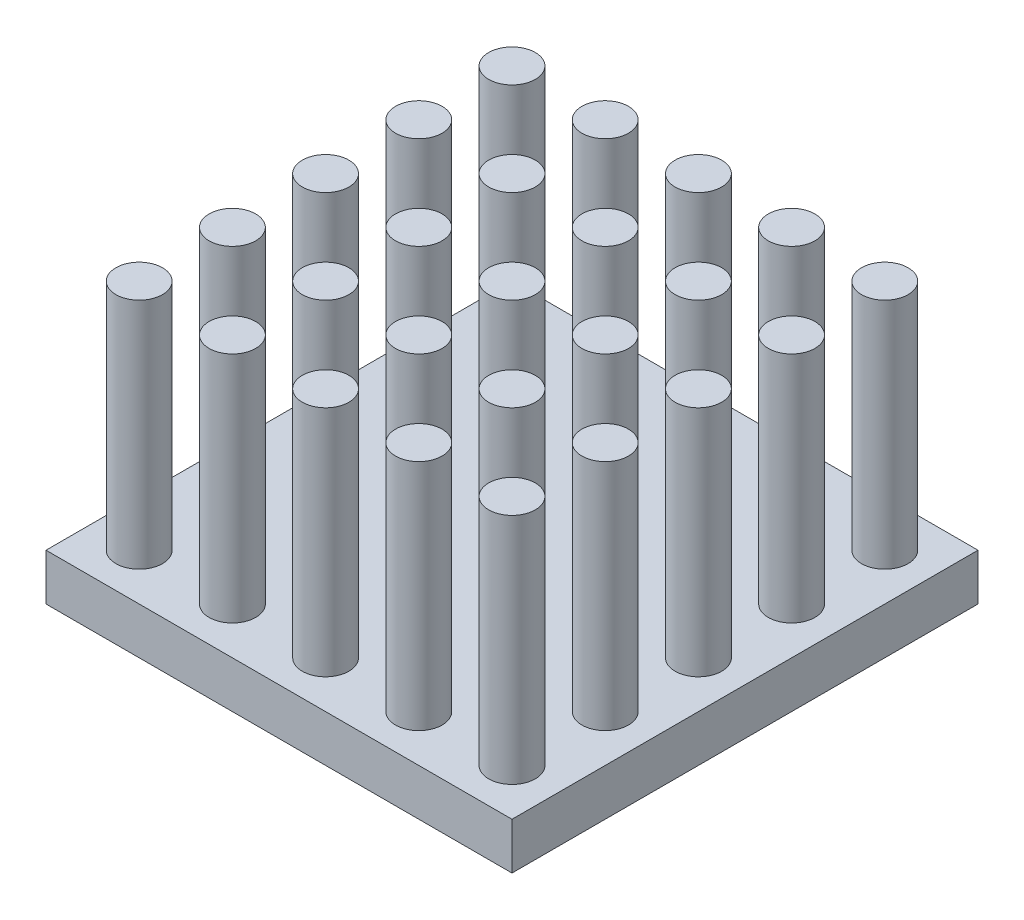
from build123d import *

# Parameters (mm, degrees)
SKETCH_1_W                        = 10
SKETCH_1_H                        = 10
EXTRUDE_1_DEPTH                   = 1
SKETCH_2_R                        = 0.5
EXTRUDE_2_DEPTH                   = 5
PATTERN_LINEAR_1_COUNT            = 5
PATTERN_LINEAR_1_PITCH            = 2
PATTERN_LINEAR_2_COUNT            = 5
PATTERN_LINEAR_2_PITCH            = 2
PATTERN_LINEAR_2_COPY_1_SKETCH_R  = 0.5
PATTERN_LINEAR_2_COPY_1_DEPTH     = 5
PATTERN_LINEAR_2_COPY_2_SKETCH_R  = 0.5
PATTERN_LINEAR_2_COPY_2_DEPTH     = 5
PATTERN_LINEAR_2_COPY_3_SKETCH_R  = 0.5
PATTERN_LINEAR_2_COPY_3_DEPTH     = 5
PATTERN_LINEAR_2_COPY_4_SKETCH_R  = 0.5
PATTERN_LINEAR_2_COPY_4_DEPTH     = 5
PATTERN_LINEAR_2_COPY_5_SKETCH_R  = 0.5
PATTERN_LINEAR_2_COPY_5_DEPTH     = 5
PATTERN_LINEAR_2_COPY_6_SKETCH_R  = 0.5
PATTERN_LINEAR_2_COPY_6_DEPTH     = 5
PATTERN_LINEAR_2_COPY_7_SKETCH_R  = 0.5
PATTERN_LINEAR_2_COPY_7_DEPTH     = 5
PATTERN_LINEAR_2_COPY_8_SKETCH_R  = 0.5
PATTERN_LINEAR_2_COPY_8_DEPTH     = 5
PATTERN_LINEAR_2_COPY_9_SKETCH_R  = 0.5
PATTERN_LINEAR_2_COPY_9_DEPTH     = 5
PATTERN_LINEAR_2_COPY_10_SKETCH_R = 0.5
PATTERN_LINEAR_2_COPY_10_DEPTH    = 5
PATTERN_LINEAR_2_COPY_11_SKETCH_R = 0.5
PATTERN_LINEAR_2_COPY_11_DEPTH    = 5
PATTERN_LINEAR_2_COPY_12_SKETCH_R = 0.5
PATTERN_LINEAR_2_COPY_12_DEPTH    = 5
PATTERN_LINEAR_2_COPY_13_SKETCH_R = 0.5
PATTERN_LINEAR_2_COPY_13_DEPTH    = 5
PATTERN_LINEAR_2_COPY_14_SKETCH_R = 0.5
PATTERN_LINEAR_2_COPY_14_DEPTH    = 5
PATTERN_LINEAR_2_COPY_15_SKETCH_R = 0.5
PATTERN_LINEAR_2_COPY_15_DEPTH    = 5
PATTERN_LINEAR_2_COPY_16_SKETCH_R = 0.5
PATTERN_LINEAR_2_COPY_16_DEPTH    = 5


with BuildPart() as part:
    # 草圖1 → 填料-伸長1 (new body)
    with BuildSketch(Plane(origin=(0, 0, 0), x_dir=(1, 0, 0), z_dir=(0, 1, 0))):
        Rectangle(SKETCH_1_W, SKETCH_1_H)
    extrude(amount=EXTRUDE_1_DEPTH)

    # 草圖2 → 填料-伸長2 (add)
    with BuildSketch(Plane(origin=(0, 1, 0), x_dir=(1, 0, 0), z_dir=(0, 1, 0))):
        with Locations(Location((-4, 4, 0), (0, 0, 90))):
            Circle(SKETCH_2_R)
    extrude_2 = extrude(amount=EXTRUDE_2_DEPTH)

    # 直線複製排列1: 填料-伸長2 ×5
    with Locations(*[(i * PATTERN_LINEAR_1_PITCH, 0, 0) for i in range(1, PATTERN_LINEAR_1_COUNT)]):
        add(extrude_2)

    # 直線複製排列2: 填料-伸長2 ×5
    with Locations(*[(0, 0, i * PATTERN_LINEAR_2_PITCH) for i in range(1, PATTERN_LINEAR_2_COUNT)]):
        add(extrude_2)

    # 直線複製排列2 copy 1 sketch → 直線複製排列2 copy 1 (add)
    with BuildSketch(Plane(origin=(2, 1, 2), x_dir=(1, 0, 0), z_dir=(0, 1, 0))):
        with Locations(Location((-4, 4, 0), (0, 0, 90))):
            Circle(PATTERN_LINEAR_2_COPY_1_SKETCH_R)
    extrude(amount=PATTERN_LINEAR_2_COPY_1_DEPTH)

    # 直線複製排列2 copy 2 sketch → 直線複製排列2 copy 2 (add)
    with BuildSketch(Plane(origin=(2, 1, 4), x_dir=(1, 0, 0), z_dir=(0, 1, 0))):
        with Locations(Location((-4, 4, 0), (0, 0, 90))):
            Circle(PATTERN_LINEAR_2_COPY_2_SKETCH_R)
    extrude(amount=PATTERN_LINEAR_2_COPY_2_DEPTH)

    # 直線複製排列2 copy 3 sketch → 直線複製排列2 copy 3 (add)
    with BuildSketch(Plane(origin=(2, 1, 6), x_dir=(1, 0, 0), z_dir=(0, 1, 0))):
        with Locations(Location((-4, 4, 0), (0, 0, 90))):
            Circle(PATTERN_LINEAR_2_COPY_3_SKETCH_R)
    extrude(amount=PATTERN_LINEAR_2_COPY_3_DEPTH)

    # 直線複製排列2 copy 4 sketch → 直線複製排列2 copy 4 (add)
    with BuildSketch(Plane(origin=(2, 1, 8), x_dir=(1, 0, 0), z_dir=(0, 1, 0))):
        with Locations(Location((-4, 4, 0), (0, 0, 90))):
            Circle(PATTERN_LINEAR_2_COPY_4_SKETCH_R)
    extrude(amount=PATTERN_LINEAR_2_COPY_4_DEPTH)

    # 直線複製排列2 copy 5 sketch → 直線複製排列2 copy 5 (add)
    with BuildSketch(Plane(origin=(4, 1, 2), x_dir=(1, 0, 0), z_dir=(0, 1, 0))):
        with Locations(Location((-4, 4, 0), (0, 0, 90))):
            Circle(PATTERN_LINEAR_2_COPY_5_SKETCH_R)
    extrude(amount=PATTERN_LINEAR_2_COPY_5_DEPTH)

    # 直線複製排列2 copy 6 sketch → 直線複製排列2 copy 6 (add)
    with BuildSketch(Plane(origin=(4, 1, 4), x_dir=(1, 0, 0), z_dir=(0, 1, 0))):
        with Locations(Location((-4, 4, 0), (0, 0, 90))):
            Circle(PATTERN_LINEAR_2_COPY_6_SKETCH_R)
    extrude(amount=PATTERN_LINEAR_2_COPY_6_DEPTH)

    # 直線複製排列2 copy 7 sketch → 直線複製排列2 copy 7 (add)
    with BuildSketch(Plane(origin=(4, 1, 6), x_dir=(1, 0, 0), z_dir=(0, 1, 0))):
        with Locations(Location((-4, 4, 0), (0, 0, 90))):
            Circle(PATTERN_LINEAR_2_COPY_7_SKETCH_R)
    extrude(amount=PATTERN_LINEAR_2_COPY_7_DEPTH)

    # 直線複製排列2 copy 8 sketch → 直線複製排列2 copy 8 (add)
    with BuildSketch(Plane(origin=(4, 1, 8), x_dir=(1, 0, 0), z_dir=(0, 1, 0))):
        with Locations(Location((-4, 4, 0), (0, 0, 90))):
            Circle(PATTERN_LINEAR_2_COPY_8_SKETCH_R)
    extrude(amount=PATTERN_LINEAR_2_COPY_8_DEPTH)

    # 直線複製排列2 copy 9 sketch → 直線複製排列2 copy 9 (add)
    with BuildSketch(Plane(origin=(6, 1, 2), x_dir=(1, 0, 0), z_dir=(0, 1, 0))):
        with Locations(Location((-4, 4, 0), (0, 0, 90))):
            Circle(PATTERN_LINEAR_2_COPY_9_SKETCH_R)
    extrude(amount=PATTERN_LINEAR_2_COPY_9_DEPTH)

    # 直線複製排列2 copy 10 sketch → 直線複製排列2 copy 10 (add)
    with BuildSketch(Plane(origin=(6, 1, 4), x_dir=(1, 0, 0), z_dir=(0, 1, 0))):
        with Locations(Location((-4, 4, 0), (0, 0, 90))):
            Circle(PATTERN_LINEAR_2_COPY_10_SKETCH_R)
    extrude(amount=PATTERN_LINEAR_2_COPY_10_DEPTH)

    # 直線複製排列2 copy 11 sketch → 直線複製排列2 copy 11 (add)
    with BuildSketch(Plane(origin=(6, 1, 6), x_dir=(1, 0, 0), z_dir=(0, 1, 0))):
        with Locations(Location((-4, 4, 0), (0, 0, 90))):
            Circle(PATTERN_LINEAR_2_COPY_11_SKETCH_R)
    extrude(amount=PATTERN_LINEAR_2_COPY_11_DEPTH)

    # 直線複製排列2 copy 12 sketch → 直線複製排列2 copy 12 (add)
    with BuildSketch(Plane(origin=(6, 1, 8), x_dir=(1, 0, 0), z_dir=(0, 1, 0))):
        with Locations(Location((-4, 4, 0), (0, 0, 90))):
            Circle(PATTERN_LINEAR_2_COPY_12_SKETCH_R)
    extrude(amount=PATTERN_LINEAR_2_COPY_12_DEPTH)

    # 直線複製排列2 copy 13 sketch → 直線複製排列2 copy 13 (add)
    with BuildSketch(Plane(origin=(8, 1, 2), x_dir=(1, 0, 0), z_dir=(0, 1, 0))):
        with Locations(Location((-4, 4, 0), (0, 0, 90))):
            Circle(PATTERN_LINEAR_2_COPY_13_SKETCH_R)
    extrude(amount=PATTERN_LINEAR_2_COPY_13_DEPTH)

    # 直線複製排列2 copy 14 sketch → 直線複製排列2 copy 14 (add)
    with BuildSketch(Plane(origin=(8, 1, 4), x_dir=(1, 0, 0), z_dir=(0, 1, 0))):
        with Locations(Location((-4, 4, 0), (0, 0, 90))):
            Circle(PATTERN_LINEAR_2_COPY_14_SKETCH_R)
    extrude(amount=PATTERN_LINEAR_2_COPY_14_DEPTH)

    # 直線複製排列2 copy 15 sketch → 直線複製排列2 copy 15 (add)
    with BuildSketch(Plane(origin=(8, 1, 6), x_dir=(1, 0, 0), z_dir=(0, 1, 0))):
        with Locations(Location((-4, 4, 0), (0, 0, 90))):
            Circle(PATTERN_LINEAR_2_COPY_15_SKETCH_R)
    extrude(amount=PATTERN_LINEAR_2_COPY_15_DEPTH)

    # 直線複製排列2 copy 16 sketch → 直線複製排列2 copy 16 (add)
    with BuildSketch(Plane(origin=(8, 1, 8), x_dir=(1, 0, 0), z_dir=(0, 1, 0))):
        with Locations(Location((-4, 4, 0), (0, 0, 90))):
            Circle(PATTERN_LINEAR_2_COPY_16_SKETCH_R)
    extrude(amount=PATTERN_LINEAR_2_COPY_16_DEPTH)


solid = part.part
